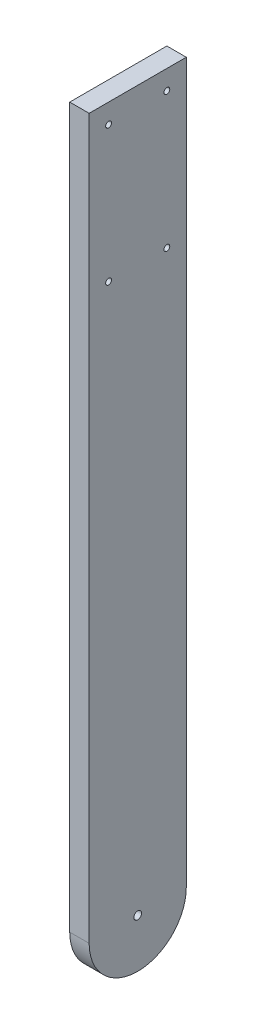
from build123d import *

# Parameters (mm, degrees)
BOSS_EXTRUDE2_DEPTH = 5
SKETCH4_R           = 0.75
CUT_EXTRUDE1_DEPTH  = 5
SKETCH5_R           = 1
CUT_EXTRUDE2_DEPTH  = 5


with BuildPart() as part:
    # Sketch3 → Boss-Extrude2 (new body)
    with BuildSketch(Plane(origin=(0, 0, 0), x_dir=(0, 0, -1), z_dir=(1, 0, 0))):
        with BuildLine():
            Line((12.5, 100), (-12.5, 100))
            Line((-12.5, 100), (-12.5, -85))
            ThreePointArc((-12.5, -85), (0, -97.5), (12.5, -85))
            Line((12.5, -85), (12.5, 100))
        make_face()
    extrude(amount=BOSS_EXTRUDE2_DEPTH)

    # Sketch4 → Cut-Extrude1 (cut)
    with BuildSketch(Plane.ZY):
        with Locations((-7.5, 95)):
            Circle(SKETCH4_R)
        with Locations(Location((-7.5, 60, 0), (0, 0, 180))):
            Circle(SKETCH4_R)
        with Locations((7.5, 60)):
            Circle(SKETCH4_R)
        with Locations(Location((7.5, 95, 0), (0, 0, 180))):
            Circle(SKETCH4_R)
    extrude(amount=-CUT_EXTRUDE1_DEPTH, mode=Mode.SUBTRACT)

    # Sketch5 → Cut-Extrude2 (cut)
    with BuildSketch(Plane.ZY):
        with Locations((0, -85)):
            Circle(SKETCH5_R)
    extrude(amount=-CUT_EXTRUDE2_DEPTH, mode=Mode.SUBTRACT)


solid = part.part
